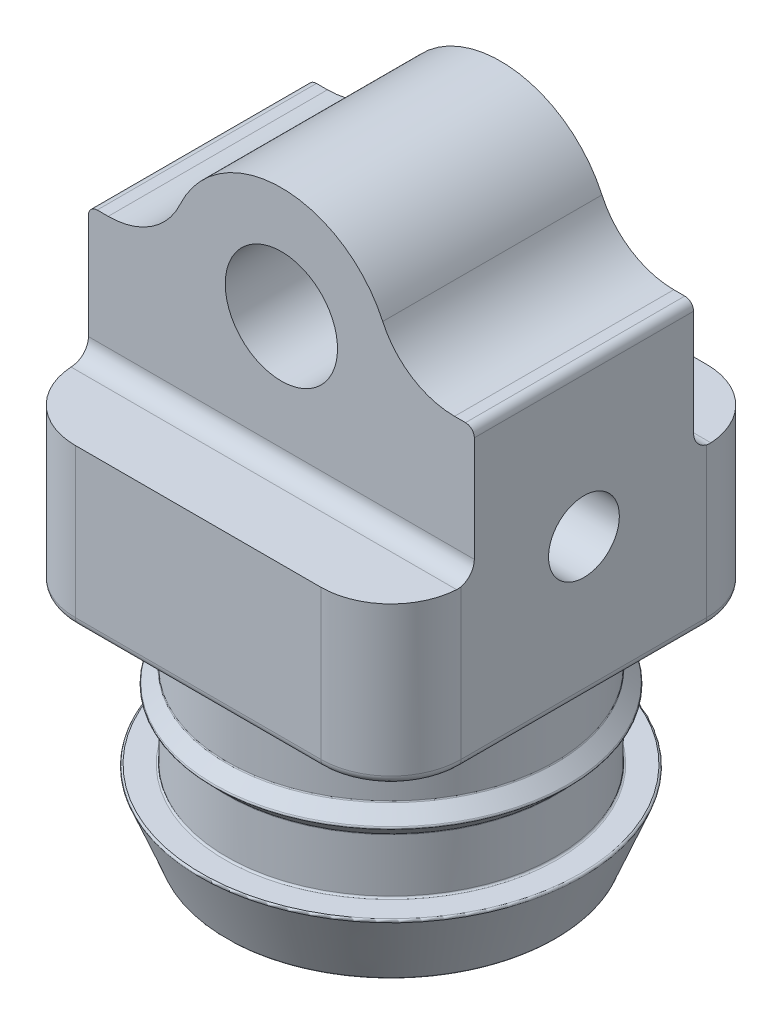
from build123d import *

# Parameters (mm, degrees)
SKETCH1_R                  = 3.2
BOSS_EXTRUDE1_DEPTH        = 11
SKETCH3_R                  = 4
CUT_EXTRUDE1_DEPTH         = 20.5
F_10_32_TAPPED_HOLE1_D     = 4.0386
F_10_32_TAPPED_HOLE1_DEPTH = 15.43
F_10_32_TAPPED_HOLE1_TIP   = 1.213317848
FILLET3_R                  = 0.1
FILLET7_R                  = 4.5
FILLET6_R                  = 4
FILLET8_R                  = 0.5
SKETCH7_W                  = 5.821303724
SKETCH7_H                  = 14.104820839
CUT_EXTRUDE3_DEPTH         = 39.179052011
FILLET9_R                  = 1


with BuildPart() as part:
    # Sketch1 → Boss-Extrude1 (new, symmetric)
    with BuildSketch(Plane.XY):
        with BuildLine():
            Line((-11, 0), (-6.35, 0))
            ThreePointArc((-6.35, 0), (0, 6.35), (6.35, 0))
            Line((6.35, 0), (11, 0))
            Line((11, 0), (11, -16.5))
            Line((11, -16.5), (-11, -16.5))
            Line((-11, -16.5), (-11, 0))
        make_face()
        Circle(SKETCH1_R, mode=Mode.SUBTRACT)
    extrude(amount=BOSS_EXTRUDE1_DEPTH, both=True)

    # Sketch2 → Revolve1 (revolve)
    with BuildSketch(Plane.XY, mode=Mode.PRIVATE) as revolve1_sk:
        Polygon((0, -16.5), (9.365, -16.5), (9.365, -20.46875), (10.15875, -21.2625), (9.365, -22.05625), (9.365, -25.23125), (10.9525, -25.23125), (9.365, -29.2), (0, -29.2), align=None)
    revolve(revolve1_sk.sketch.rotate(Axis((0, 9.54404991, 0), (0, -1, 0)), 180), axis=Axis((0, 9.54404991, 0), (0, -1, 0)))

    # Sketch3 → Cut-Extrude1 (cut)
    with BuildSketch(Plane.XZ.offset(29.2)):
        Circle(SKETCH3_R)
    extrude(amount=-CUT_EXTRUDE1_DEPTH, mode=Mode.SUBTRACT)

    # #10-32 Tapped Hole1
    with Locations(Plane(origin=(11, 0, 0), x_dir=(0, 0, -1), z_dir=(1, 0, 0))):
        with Locations((0, -8.5)):
            Hole(F_10_32_TAPPED_HOLE1_D / 2, depth=F_10_32_TAPPED_HOLE1_DEPTH)
            with Locations((0, 0, -(F_10_32_TAPPED_HOLE1_DEPTH + F_10_32_TAPPED_HOLE1_TIP / 2))):  # 118° drill point
                Cone(0, F_10_32_TAPPED_HOLE1_D / 2, F_10_32_TAPPED_HOLE1_TIP, mode=Mode.SUBTRACT)

    # Fillet3
    fillet3_edges = [part.edges().sort_by_distance(p)[0] for p in [
        (9.365, -16.5, 0),
        (9.365, -20.46875, 0),
        (10.15875, -21.2625, 0),
        (9.365, -22.05625, 0),
        (9.365, -25.23125, 0),
        (10.9525, -25.23125, 0),
        (9.365, -29.2, 0),
    ]]
    fillet(fillet3_edges, radius=FILLET3_R)

    # Fillet7
    fillet7_edges = [part.edges().sort_by_distance(p)[0] for p in [
        (6.35, 0, 0),
        (-6.35, 0, 0),
    ]]
    fillet(fillet7_edges, radius=FILLET7_R)

    # Fillet6
    fillet6_edges = [part.edges().sort_by_distance(p)[0] for p in [
        (11, -8.25, -11),
        (-11, -8.25, -11),
        (-11, -8.25, 11),
        (11, -8.25, 11),
    ]]
    fillet(fillet6_edges, radius=FILLET6_R)

    # Fillet8
    fillet8_edges = [part.edges().sort_by_distance(p)[0] for p in [
        (0, 6.35, -11),
        (0, 6.35, 11),
        (-6.298677383, 1.765858158, 11),
        (6.298677383, 1.765858158, -11),
        (11, 0, 0),
        (11, -16.5, 0),
        (10.707510274, 0, 8.501455151),
        (10.707510274, 0, -8.501455151),
        (6.298677383, 1.765858158, 11),
        (8.469550334, 0.224389567, 10.720271757),
        (8.469550334, 0.224389567, -10.720271757),
        (0, -16.5, -11),
        (-6.298677383, 1.765858158, -11),
        (0, -16.5, 11),
        (-11, -16.5, 0),
        (9.828427125, -16.5, 9.828427125),
        (-9.828427125, -16.5, 9.828427125),
        (-9.828427125, -16.5, -9.828427125),
        (9.828427125, -16.5, -9.828427125),
        (-11, 0, 0),
        (-8.469550334, 0.224389567, 10.720271757),
        (-8.469550334, 0.224389567, -10.720271757),
        (-10.707510274, 0, 8.501455151),
        (-10.707510274, 0, -8.501455151),
    ]]
    fillet(fillet8_edges, radius=FILLET8_R)

    # Sketch7 → Cut-Extrude3 (cut, through all)
    with BuildSketch(Plane(origin=(11, 0, 0), x_dir=(0, 0, -1), z_dir=(1, 0, 0))):
        with Locations((-9.160651862, -0.447589581)):
            Rectangle(SKETCH7_W, SKETCH7_H)
        with Locations((9.160651862, -0.447589581)):
            Rectangle(SKETCH7_W, SKETCH7_H)
    extrude(amount=-CUT_EXTRUDE3_DEPTH, mode=Mode.SUBTRACT)

    # Fillet9
    fillet9_edges = [part.edges().sort_by_distance(p)[0] for p in [
        (0, -7.5, -6.25),
        (0, -7.5, 6.25),
    ]]
    fillet(fillet9_edges, radius=FILLET9_R)


solid = part.part
